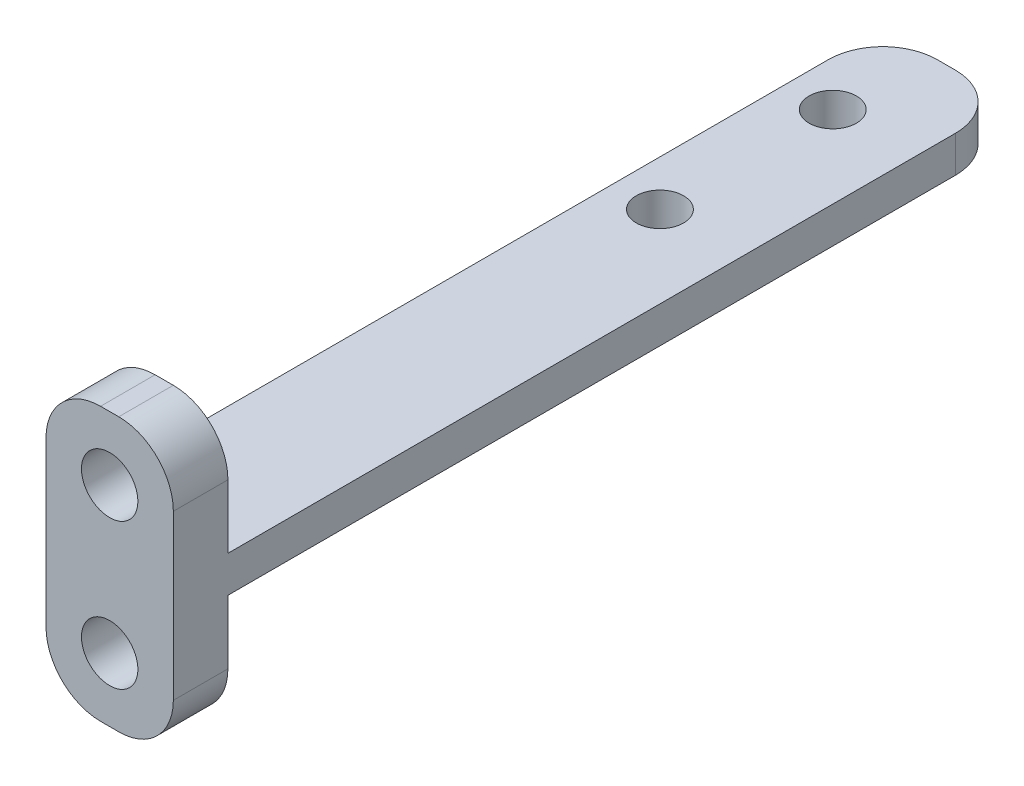
from build123d import *

# Parameters (mm, degrees)
SKETCH_1_W           = 7
SKETCH_1_H           = 43
SKETCH_1_R           = 1.3
EXTRUDE_1_DEPTH      = 2
EXTRUDE_2_DEPTH      = 8.5
EXTRUDE_2_DEPTH_BACK = 6.5
SKETCH_2_W           = 7
SKETCH_2_H           = 3
SKETCH_3_R           = 1.55
CUT_EXTRUDE_1_DEPTH  = 27.167728216
FILLET_1_R           = 3
FILLET_2_R           = 3


with BuildPart() as part:
    # 草图1 → 凸台-拉伸1 (new body)
    with BuildSketch(Plane(origin=(0, 0, 0), x_dir=(1, 0, 0), z_dir=(0, 1, 0))):
        Rectangle(SKETCH_1_W, SKETCH_1_H)
        with Locations(Location((-1, 16.25, 0), (0, 0, 270))):
            Circle(SKETCH_1_R, mode=Mode.SUBTRACT)
        with Locations(Location((-1, 6.75, 0), (0, 0, 90))):
            Circle(SKETCH_1_R, mode=Mode.SUBTRACT)
    extrude(amount=EXTRUDE_1_DEPTH)

    # 草图2 → 凸台-拉伸2 (add, two sides: drawn at the far end of the back side and taken through both)
    with BuildSketch(Plane(origin=(0, 0, 0), x_dir=(1, 0, 0), z_dir=(0, 1, 0)).offset(-EXTRUDE_2_DEPTH_BACK)):
        with Locations((0, -23)):
            Rectangle(SKETCH_2_W, SKETCH_2_H)
    extrude(amount=EXTRUDE_2_DEPTH + EXTRUDE_2_DEPTH_BACK)

    # 草图3 → 切除-拉伸1 (cut, through all)
    with BuildSketch(Plane.XY):
        with Locations(Location((0, 5, 0), (0, 0, 180))):
            Circle(SKETCH_3_R)
        with Locations(Location((0, -3, 0), (0, 0, 180))):
            Circle(SKETCH_3_R)
    extrude(amount=CUT_EXTRUDE_1_DEPTH, mode=Mode.SUBTRACT)

    # 圆角1
    fillet_1_edges = [part.edges().sort_by_distance(p)[0] for p in [
        (-3.5, 1, -21.5),
        (3.5, 1, -21.5),
    ]]
    fillet(fillet_1_edges, radius=FILLET_1_R)

    # 圆角2
    fillet_2_edges = [part.edges().sort_by_distance(p)[0] for p in [
        (3.5, -6.5, 23),
        (-3.5, -6.5, 23),
        (3.5, 8.5, 23),
        (-3.5, 8.5, 23),
    ]]
    fillet(fillet_2_edges, radius=FILLET_2_R)


solid = part.part
